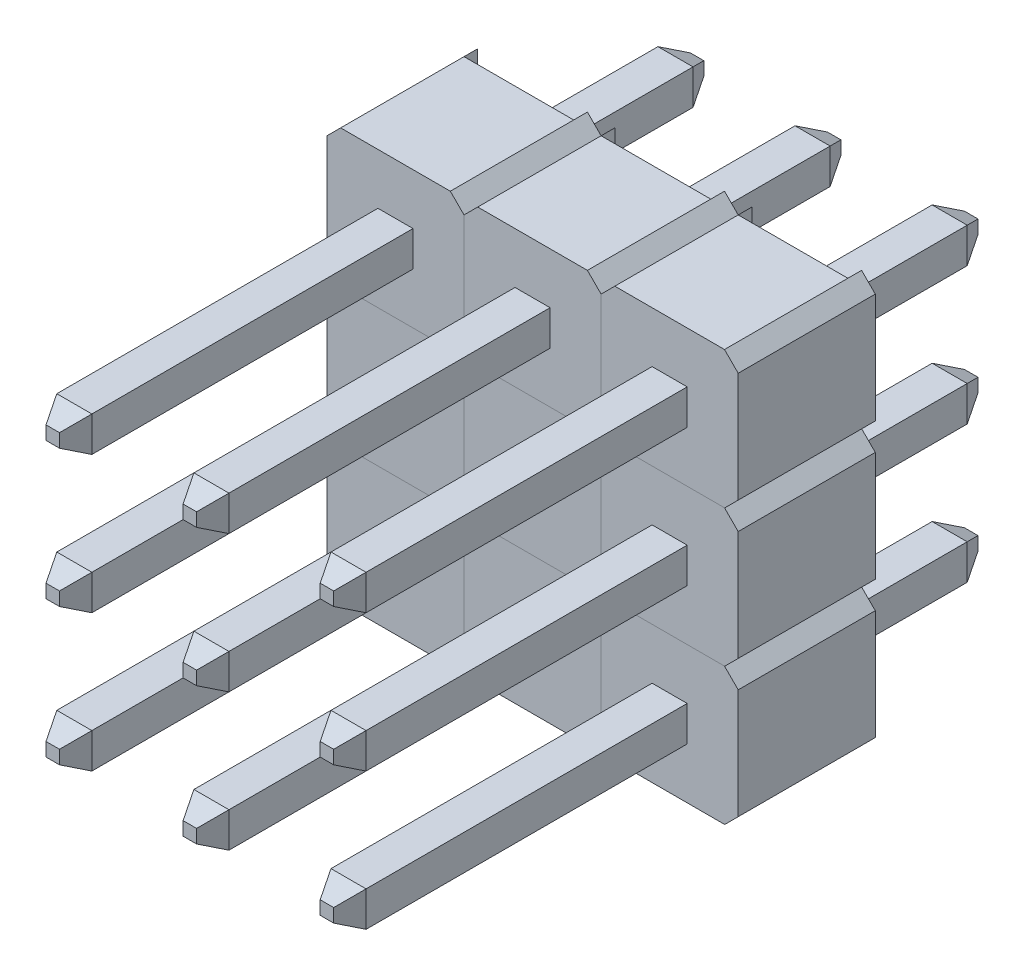
from build123d import *
from OCP.BRepFilletAPI import BRepFilletAPI_MakeChamfer

# Parameters (mm, degrees)
BOSS_EXTRUDE1_DEPTH = 2.286
BOSS_EXTRUDE2_DEPTH = 0.254
BOSS_EXTRUDE3_DEPTH = 0.254
SKETCH4_W           = 0.65
SKETCH4_H           = 0.65
BOSS_EXTRUDE4_DEPTH = 3.302
SKETCH5_W           = 0.65
SKETCH5_H           = 0.65
BOSS_EXTRUDE5_DEPTH = 6.35
SKETCH6_W           = 0.65
SKETCH6_H           = 0.65
BOSS_EXTRUDE6_DEPTH = 3.302
SKETCH7_W           = 0.65
SKETCH7_H           = 0.65
BOSS_EXTRUDE7_DEPTH = 6.35
CHAMFER1_SIZE       = 0.2
CHAMFER1_SIZE2      = 0.4
SKETCH8_W           = 3.672475737
SKETCH8_H           = 13.613011567
CUT_EXTRUDE1_DEPTH  = 10
CHAMFER2_SIZE       = 0.25
LPATTERN1_COUNT     = 3
LPATTERN1_PITCH     = 2.54
LPATTERN2_COUNT     = 3
LPATTERN2_PITCH     = 2.54


with BuildPart() as part:
    # Sketch1 → Boss-Extrude1 (new body)
    with BuildSketch(Plane.XY.offset(2.54)):
        Polygon((1.27, -1.016), (1.27, 3.556), (1.016, 3.81), (-1.016, 3.81), (-1.27, 3.556), (-1.27, -1.016), (-1.016, -1.27), (1.016, -1.27), align=None)
    extrude(amount=-BOSS_EXTRUDE1_DEPTH)

    # Sketch2 → Boss-Extrude2 (add)
    with BuildSketch(Plane(origin=(0, 0, 0.254), x_dir=(-1, 0, 0), z_dir=(0, 0, -1))):
        Polygon((1.016, -1.27), (1.016, 3.81), (1.27, 3.556), (1.27, -1.016), align=None)
    extrude(amount=BOSS_EXTRUDE2_DEPTH)

    # Sketch3 → Boss-Extrude3 (add)
    with BuildSketch(Plane(origin=(0, 0, 0.254), x_dir=(-1, 0, 0), z_dir=(0, 0, -1))):
        Polygon((-1.27, -1.016), (-1.27, 3.556), (-1.016, 3.81), (-1.016, -1.27), align=None)
    extrude(amount=BOSS_EXTRUDE3_DEPTH)

    # Sketch4 → Boss-Extrude4 (add)
    with BuildSketch(Plane(origin=(0, 0, 0.254), x_dir=(-1, 0, 0), z_dir=(0, 0, -1))):
        Rectangle(SKETCH4_W, SKETCH4_H)
    extrude(amount=BOSS_EXTRUDE4_DEPTH)

    # Sketch5 → Boss-Extrude5 (add)
    with BuildSketch(Plane.XY.offset(2.54)):
        Rectangle(SKETCH5_W, SKETCH5_H)
    extrude(amount=BOSS_EXTRUDE5_DEPTH)

    # Sketch6 → Boss-Extrude6 (add)
    with BuildSketch(Plane(origin=(0, 0, 0.254), x_dir=(-1, 0, 0), z_dir=(0, 0, -1))):
        with Locations((0, 2.54)):
            Rectangle(SKETCH6_W, SKETCH6_H)
    extrude(amount=BOSS_EXTRUDE6_DEPTH)

    # Sketch7 → Boss-Extrude7 (add)
    with BuildSketch(Plane.XY.offset(2.54)):
        with Locations((0, 2.54)):
            Rectangle(SKETCH7_W, SKETCH7_H)
    extrude(amount=BOSS_EXTRUDE7_DEPTH)

    # Chamfer1: one chamfer whose edges measure the first distance from different faces: ONE call of the kernel's chamfer builder (chamfer() names one face for all edges)
    chamfer1_edges_1 = [part.edges().sort_by_distance(p)[0] for p in [
        (0, 0.325, -3.048),
        (0.325, 0, -3.048),
        (0, -0.325, -3.048),
        (-0.325, 0, -3.048),
    ]]
    chamfer1_side_1 = [part.faces().sort_by_distance(p)[0] for p in [
        (0, 0, -3.048),
    ]]
    chamfer1_edges_2 = [part.edges().sort_by_distance(p)[0] for p in [
        (0, 0.325, 8.89),
        (-0.325, 0, 8.89),
        (0, -0.325, 8.89),
        (0.325, 0, 8.89),
    ]]
    chamfer1_side_2 = [part.faces().sort_by_distance(p)[0] for p in [
        (0, 0, 8.89),
    ]]
    chamfer1_edges_3 = [part.edges().sort_by_distance(p)[0] for p in [
        (0, 2.215, -3.048),
        (-0.325, 2.54, -3.048),
        (0, 2.865, -3.048),
        (0.325, 2.54, -3.048),
    ]]
    chamfer1_side_3 = [part.faces().sort_by_distance(p)[0] for p in [
        (0, 2.54, -3.048),
    ]]
    chamfer1_edges_4 = [part.edges().sort_by_distance(p)[0] for p in [
        (-0.325, 2.54, 8.89),
        (0, 2.215, 8.89),
        (0.325, 2.54, 8.89),
        (0, 2.865, 8.89),
    ]]
    chamfer1_side_4 = [part.faces().sort_by_distance(p)[0] for p in [
        (0, 2.54, 8.89),
    ]]
    chamfer1 = BRepFilletAPI_MakeChamfer(part.part.solid().wrapped)
    for e in chamfer1_edges_1:
        chamfer1.Add(CHAMFER1_SIZE, CHAMFER1_SIZE2, e.wrapped, chamfer1_side_1[0].wrapped)  # the first distance lies on this face
    for e in chamfer1_edges_2:
        chamfer1.Add(CHAMFER1_SIZE, CHAMFER1_SIZE2, e.wrapped, chamfer1_side_2[0].wrapped)  # the first distance lies on this face
    for e in chamfer1_edges_3:
        chamfer1.Add(CHAMFER1_SIZE, CHAMFER1_SIZE2, e.wrapped, chamfer1_side_3[0].wrapped)  # the first distance lies on this face
    for e in chamfer1_edges_4:
        chamfer1.Add(CHAMFER1_SIZE, CHAMFER1_SIZE2, e.wrapped, chamfer1_side_4[0].wrapped)  # the first distance lies on this face
    add(Compound.cast(chamfer1.Shape()), mode=Mode.REPLACE)

    # Sketch8 → Cut-Extrude1 (cut)
    with BuildSketch(Plane(origin=(0, 1.27, 0), x_dir=(1, 0, 0), z_dir=(0, 1, 0))):
        with Locations((0.124256698, -2.851968502)):
            Rectangle(SKETCH8_W, SKETCH8_H)
    extrude(amount=-CUT_EXTRUDE1_DEPTH, mode=Mode.SUBTRACT)

    # Chamfer2
    chamfer2_edges = [part.edges().sort_by_distance(p)[0] for p in [
        (-1.27, 1.27, 1.27),
        (1.27, 1.27, 1.27),
    ]]
    chamfer(chamfer2_edges, length=CHAMFER2_SIZE)


with BuildPart() as lpattern1_1:
    # LPattern1: pattern copy
    add(part.part.moved(Location(Vector(-1, 0, 0) * (1 * LPATTERN1_PITCH))))


with BuildPart() as lpattern1_2:
    # LPattern1: pattern copy
    add(part.part.moved(Location(Vector(-1, 0, 0) * (2 * LPATTERN1_PITCH))))


with BuildPart() as lpattern2_1:
    # LPattern2: pattern copy
    add(lpattern1_2.part.moved(Location(Vector(0, -1, 0) * (1 * LPATTERN2_PITCH))))


with BuildPart() as lpattern2_2:
    # LPattern2: pattern copy
    add(lpattern1_2.part.moved(Location(Vector(0, -1, 0) * (2 * LPATTERN2_PITCH))))


with BuildPart() as lpattern2_3:
    # LPattern2: pattern copy
    add(lpattern1_1.part.moved(Location(Vector(0, -1, 0) * (1 * LPATTERN2_PITCH))))


with BuildPart() as lpattern2_4:
    # LPattern2: pattern copy
    add(lpattern1_1.part.moved(Location(Vector(0, -1, 0) * (2 * LPATTERN2_PITCH))))


with BuildPart() as lpattern2_5:
    # LPattern2: pattern copy
    add(part.part.moved(Location(Vector(0, -1, 0) * (1 * LPATTERN2_PITCH))))


with BuildPart() as lpattern2_6:
    # LPattern2: pattern copy
    add(part.part.moved(Location(Vector(0, -1, 0) * (2 * LPATTERN2_PITCH))))


solid = Compound([part.part, lpattern1_1.part, lpattern1_2.part, lpattern2_1.part, lpattern2_2.part, lpattern2_3.part, lpattern2_4.part, lpattern2_5.part, lpattern2_6.part])
